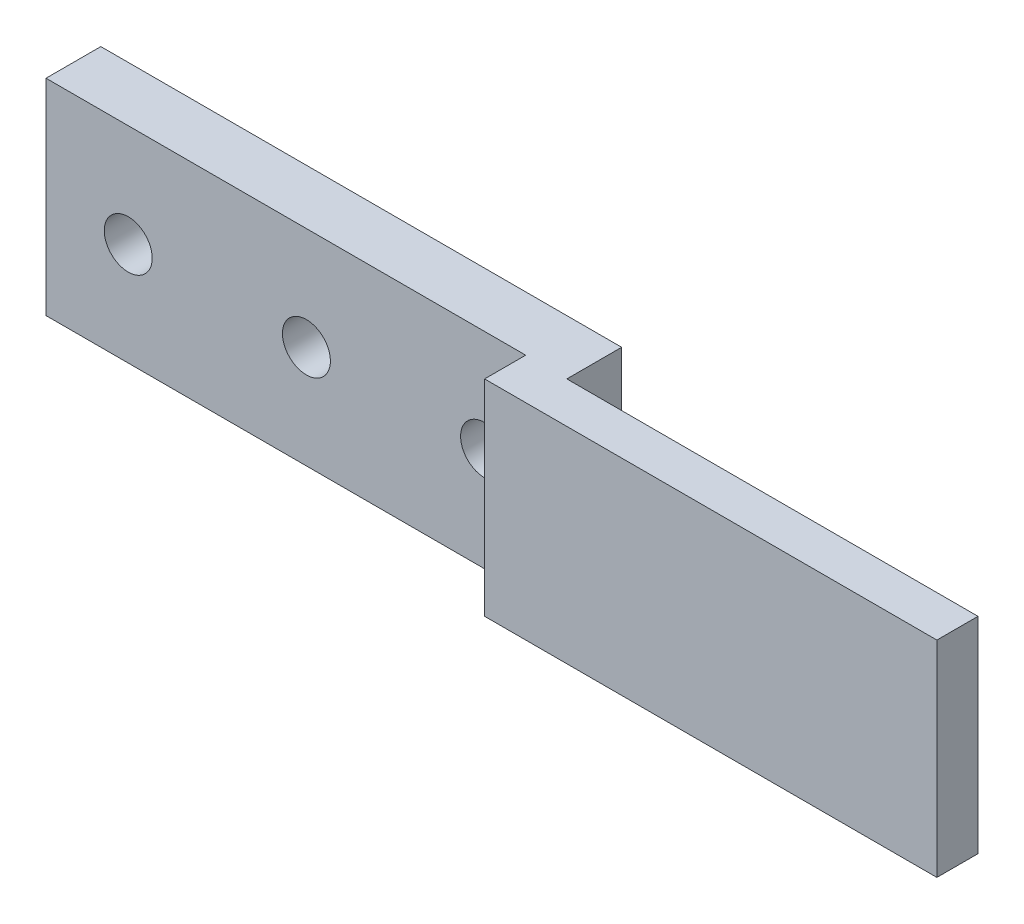
from build123d import *

# Parameters (mm, degrees)
ESBO_O1_W                = 25
ESBO_O1_H                = 15
RESSALTO_EXTRUS_O1_DEPTH = 3
ESBO_O3_W                = 3
ESBO_O3_H                = 15
RESSALTO_EXTRUS_O2_DEPTH = 3
ESBO_O5_W                = 3
ESBO_O5_H                = 15
RESSALTO_EXTRUS_O3_DEPTH = 30
ESBO_O8_W                = 25
ESBO_O8_H                = 15
RESSALTO_EXTRUS_O4_DEPTH = 1
ESBO_O9_R                = 1.75
CORTE_EXTRUS_O1_DEPTH    = 44.720704477
ESBO_O10_W               = 4
ESBO_O10_H               = 15
RESSALTO_EXTRUS_O5_DEPTH = 13
ESBO_O11_R               = 1.75
CORTE_EXTRUS_O2_DEPTH    = 44.341665866


with BuildPart() as part:
    # Esboço1 → Ressalto-extrusão1 (new body)
    with BuildSketch(Plane.XY):
        Rectangle(ESBO_O1_W, ESBO_O1_H)
    extrude(amount=RESSALTO_EXTRUS_O1_DEPTH)

    # Esboço3 → Ressalto-extrusão2 (add)
    with BuildSketch(Plane.XY.offset(3)):
        with Locations((11, 0)):
            Rectangle(ESBO_O3_W, ESBO_O3_H)
    extrude(amount=RESSALTO_EXTRUS_O2_DEPTH)

    # Esboço5 → Ressalto-extrusão3 (add)
    with BuildSketch(Plane(origin=(12.5, 0, 0), x_dir=(0, 0, -1), z_dir=(1, 0, 0))):
        with Locations((-4.5, 0)):
            Rectangle(ESBO_O5_W, ESBO_O5_H)
    extrude(amount=RESSALTO_EXTRUS_O3_DEPTH)

    # Esboço8 → Ressalto-extrusão4 (add)
    with BuildSketch(Plane(origin=(0, 0, 0), x_dir=(-1, 0, 0), z_dir=(0, 0, -1))):
        Rectangle(ESBO_O8_W, ESBO_O8_H)
    extrude(amount=RESSALTO_EXTRUS_O4_DEPTH)

    # Esboço9 → Corte-extrusão1 (cut, through all)
    with BuildSketch(Plane(origin=(0, 0, -1), x_dir=(-1, 0, 0), z_dir=(0, 0, -1))):
        with Locations((-6.5, 0)):
            Circle(ESBO_O9_R)
        with Locations(Location((6.5, 0, 0), (0, 0, 180))):
            Circle(ESBO_O9_R)
    extrude(amount=-CORTE_EXTRUS_O1_DEPTH, mode=Mode.SUBTRACT)

    # Esboço10 → Ressalto-extrusão5 (add)
    with BuildSketch(Plane.ZY.offset(12.5)):
        with Locations((1, 0)):
            Rectangle(ESBO_O10_W, ESBO_O10_H)
    extrude(amount=RESSALTO_EXTRUS_O5_DEPTH)

    # Esboço11 → Corte-extrusão2 (cut, through all)
    with BuildSketch(Plane.XY.offset(3)):
        with Locations((-19.5, 0)):
            Circle(ESBO_O11_R)
    extrude(amount=-CORTE_EXTRUS_O2_DEPTH, mode=Mode.SUBTRACT)


solid = part.part
